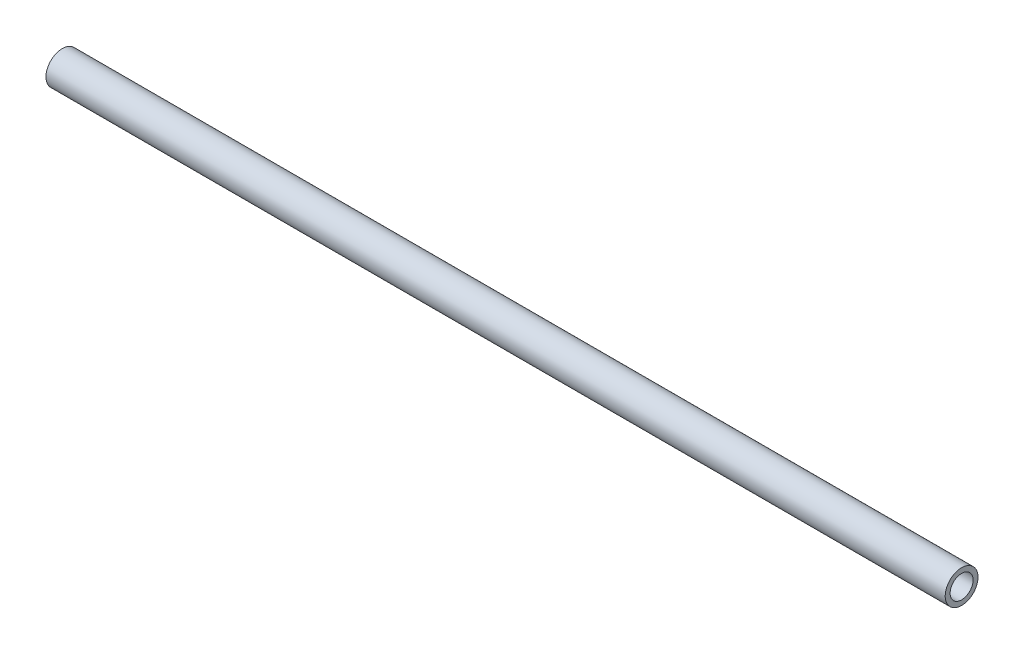
from build123d import *

# Parameters (mm, degrees)
SKETCH1_W = 548.49521355
SKETCH1_H = 3


with BuildPart() as part:
    # Sketch1 → Revolve1 (revolve)
    with BuildSketch(Plane.XY, mode=Mode.PRIVATE) as revolve1_sk:
        with Locations((0, 8.5)):
            Rectangle(SKETCH1_W, SKETCH1_H)
    revolve(revolve1_sk.sketch.rotate(Axis((265.225, 0, 0), (-1, 0, 0)), 90), axis=Axis((265.225, 0, 0), (-1, 0, 0)))


solid = part.part
